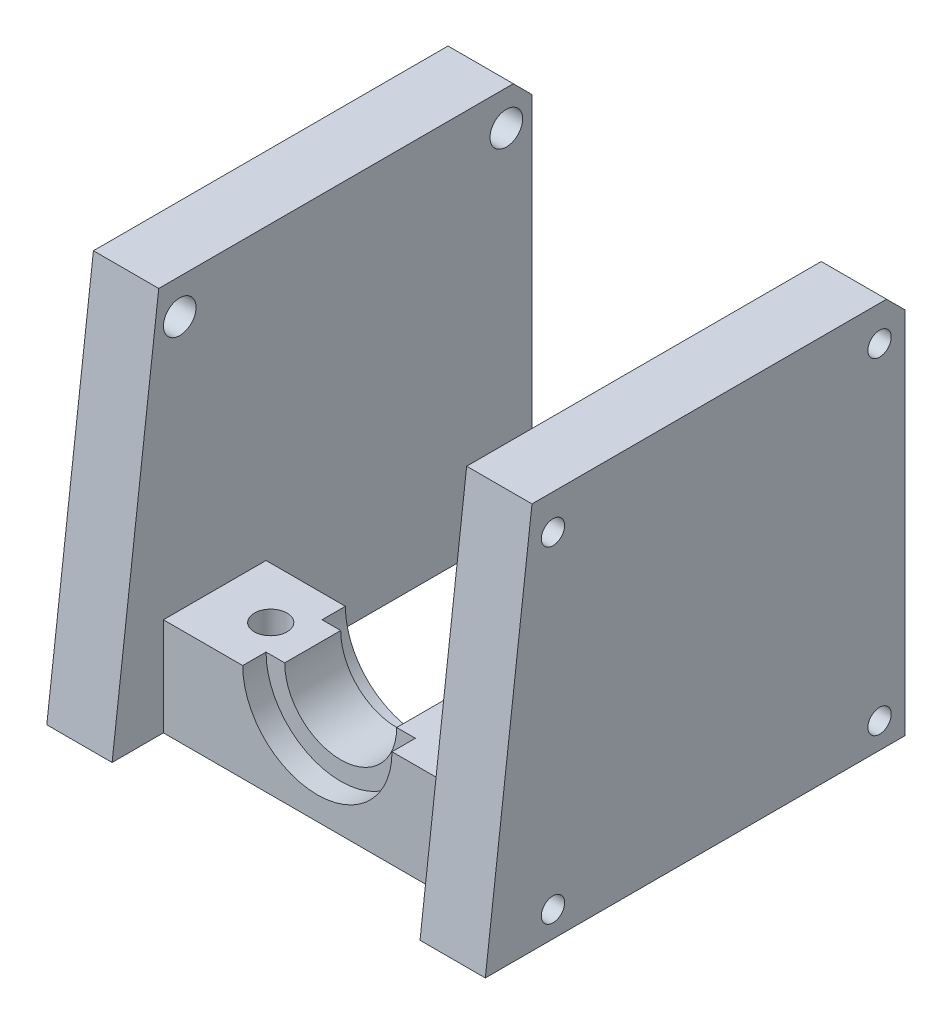
from build123d import *

# Parameters (mm, degrees)
SKETCH1_W               = 33
SKETCH1_H               = 11
SKETCH1_R               = 1.75
BOSS_EXTRUDE1_DEPTH     = 10.5
CHAMFER1_SIZE           = 2
CUT_EXTRUDE1_DEPTH      = 66.570572836
CUT_EXTRUDE1_DEPTH_BACK = 66.570572836
SKETCH3_R               = 1.25
CUT_EXTRUDE2_DEPTH      = 20.5
CUT_EXTRUDE2_DEPTH_BACK = 20.5
SKETCH3_3_R             = 1.75
SKETCH3_3_R_2           = 1.25
CUT_EXTRUDE3_START      = 23.5
SKETCH3_6_R             = 1.25
CUT_EXTRUDE3_DEPTH      = 8
CUT_EXTRUDE4_START      = -15.5
SKETCH3_7_R             = 1.25
CUT_EXTRUDE4_DEPTH      = 8
CUT_EXTRUDE5_DEPTH      = 59.570470544
CUT_EXTRUDE5_DEPTH_BACK = 59.570470544
BOSS_EXTRUDE2_DEPTH     = 3


with BuildPart() as part:
    # Sketch1 → Boss-Extrude1 (new body)
    with BuildSketch(Plane(origin=(0, 0, 0), x_dir=(1, 0, 0), z_dir=(0, 1, 0))):
        with Locations((0, 11)):
            Rectangle(SKETCH1_W, SKETCH1_H)
        with Locations(Location((-10.5, 11, 0), (0, 0, 90))):
            Circle(SKETCH1_R, mode=Mode.SUBTRACT)
        with Locations(Location((10.5, 11, 0), (0, 0, 90))):
            Circle(SKETCH1_R, mode=Mode.SUBTRACT)
    extrude(amount=BOSS_EXTRUDE1_DEPTH)

    # Sketch2 → Loft1 section 0
    with BuildSketch(Plane(origin=(0, 41.5, 0), x_dir=(1, 0, 0), z_dir=(0, 1, 0))):
        with BuildLine():
            Line((-23.5, 45), (-16.5, 45))
            Line((-16.5, 45), (-16.5, 5))
            Line((-16.5, 5), (-23.5, 5))
            Line((-23.5, 5), (-23.5, 45))
        make_face()
    # Sketch1<3> → Loft1 section 1
    with BuildSketch(Plane(origin=(0, 0, 0), x_dir=(1, 0, 0), z_dir=(0, 1, 0))):
        with BuildLine():
            Line((-23.5, 45), (-16.5, 45))
            Line((-16.5, 45), (-16.5, 0))
            Line((-16.5, 0), (-23.5, 0))
            Line((-23.5, 0), (-23.5, 45))
        make_face()
    loft()

    # Sketch2<3> → Loft2 section 0
    with BuildSketch(Plane(origin=(0, 41.5, 0), x_dir=(1, 0, 0), z_dir=(0, 1, 0))):
        with BuildLine():
            Line((16.5, 45), (16.5, 5))
            Line((16.5, 5), (23.5, 5))
            Line((23.5, 5), (23.5, 45))
            Line((23.5, 45), (16.5, 45))
        make_face()
    # Sketch1<4> → Loft2 section 1
    with BuildSketch(Plane(origin=(0, 0, 0), x_dir=(1, 0, 0), z_dir=(0, 1, 0))):
        with BuildLine():
            Line((16.5, 45), (16.5, 0))
            Line((16.5, 0), (23.5, 0))
            Line((23.5, 0), (23.5, 45))
            Line((23.5, 45), (16.5, 45))
        make_face()
    loft()

    # Chamfer1
    chamfer1_edges = [part.edges().sort_by_distance(p)[0] for p in [
        (20, 41.5, -45),
        (-20, 41.5, -45),
    ]]
    chamfer(chamfer1_edges, length=CHAMFER1_SIZE)

    # Sketch3 → Cut-Extrude1 (cut, two sides: drawn at the far end of the back side and taken through both)
    with BuildSketch(Plane(origin=(0, 0, 0), x_dir=(0, 0, -1), z_dir=(1, 0, 0)).offset(-CUT_EXTRUDE1_DEPTH_BACK)):
        with Locations((7.25, 37.75)):
            Circle(SKETCH3_R)
        with Locations((42.25, 37.75)):
            Circle(SKETCH3_R)
        with Locations((42.25, 2.75)):
            Circle(SKETCH3_R)
    extrude(amount=CUT_EXTRUDE1_DEPTH + CUT_EXTRUDE1_DEPTH_BACK, mode=Mode.SUBTRACT)

    # Sketch3<3> → Cut-Extrude2 (cut, two sides: drawn at the far end of the back side and taken through both)
    # profile 1 of 3: a face of its own
    with BuildSketch(Plane(origin=(0, 0, 0), x_dir=(0, 0, -1), z_dir=(1, 0, 0)).offset(-CUT_EXTRUDE2_DEPTH_BACK)):
        with Locations(Location((7.25, 37.75, 0), (0, 0, 180))):
            Circle(SKETCH3_3_R)
        with Locations((7.25, 37.75)):
            Circle(SKETCH3_3_R_2, mode=Mode.SUBTRACT)
    # profile 2 of 3: a face of its own
    with BuildSketch(Plane(origin=(0, 0, 0), x_dir=(0, 0, -1), z_dir=(1, 0, 0)).offset(-CUT_EXTRUDE2_DEPTH_BACK)):
        with Locations(Location((42.25, 37.75, 0), (0, 0, 180))):
            Circle(SKETCH3_3_R)
        with Locations((42.25, 37.75)):
            Circle(SKETCH3_3_R_2, mode=Mode.SUBTRACT)
    # profile 3 of 3: a face of its own
    with BuildSketch(Plane(origin=(0, 0, 0), x_dir=(0, 0, -1), z_dir=(1, 0, 0)).offset(-CUT_EXTRUDE2_DEPTH_BACK)):
        with Locations(Location((42.25, 2.75, 0), (0, 0, 180))):
            Circle(SKETCH3_3_R)
        with Locations((42.25, 2.75)):
            Circle(SKETCH3_3_R_2, mode=Mode.SUBTRACT)
    extrude(amount=CUT_EXTRUDE2_DEPTH + CUT_EXTRUDE2_DEPTH_BACK, mode=Mode.SUBTRACT)

    # Sketch3<6> → Cut-Extrude3 (cut)
    with BuildSketch(Plane(origin=(0, 0, 0), x_dir=(0, 0, -1), z_dir=(1, 0, 0)).offset(CUT_EXTRUDE3_START)):
        with Locations((7.25, 2.75)):
            Circle(SKETCH3_6_R)
    extrude(amount=-CUT_EXTRUDE3_DEPTH, mode=Mode.SUBTRACT)

    # Sketch3<7> → Cut-Extrude4 (cut)
    with BuildSketch(Plane(origin=(0, 0, 0), x_dir=(0, 0, -1), z_dir=(1, 0, 0)).offset(CUT_EXTRUDE4_START)):
        with Locations((7.25, 2.75)):
            Circle(SKETCH3_7_R)
    extrude(amount=-CUT_EXTRUDE4_DEPTH, mode=Mode.SUBTRACT)

    # Sketch4 → Cut-Extrude5 (cut, two sides: drawn at the far end of the back side and taken through both)
    with BuildSketch(Plane.XY.offset(-11).offset(-CUT_EXTRUDE5_DEPTH_BACK)):
        with BuildLine():
            ThreePointArc((-6, 10.5), (0, 16.5), (6, 10.5))
            Line((6, 10.5), (8, 10.5))
            ThreePointArc((8, 10.5), (0, 18.5), (-8, 10.5))
            Line((-8, 10.5), (-6, 10.5))
        make_face()
        with BuildLine():
            Line((8, 10.5), (6, 10.5))
            ThreePointArc((6, 10.5), (0, 4.5), (-6, 10.5))
            Line((-6, 10.5), (-8, 10.5))
            ThreePointArc((-8, 10.5), (0, 2.5), (8, 10.5))
        make_face()
        with BuildLine():
            ThreePointArc((-6, 10.5), (0, 4.5), (6, 10.5))
            Line((6, 10.5), (-6, 10.5))
        make_face()
        with BuildLine():
            Line((-6, 10.5), (6, 10.5))
            ThreePointArc((6, 10.5), (0, 16.5), (-6, 10.5))
        make_face()
    extrude(amount=CUT_EXTRUDE5_DEPTH + CUT_EXTRUDE5_DEPTH_BACK, mode=Mode.SUBTRACT)

    # Sketch4<4> → Boss-Extrude2 (add, symmetric)
    with BuildSketch(Plane.XY.offset(-11)):
        with BuildLine():
            Line((8, 10.5), (6, 10.5))
            ThreePointArc((6, 10.5), (0, 4.5), (-6, 10.5))
            Line((-6, 10.5), (-8, 10.5))
            ThreePointArc((-8, 10.5), (0, 2.5), (8, 10.5))
        make_face()
    extrude(amount=BOSS_EXTRUDE2_DEPTH, both=True)


solid = part.part
